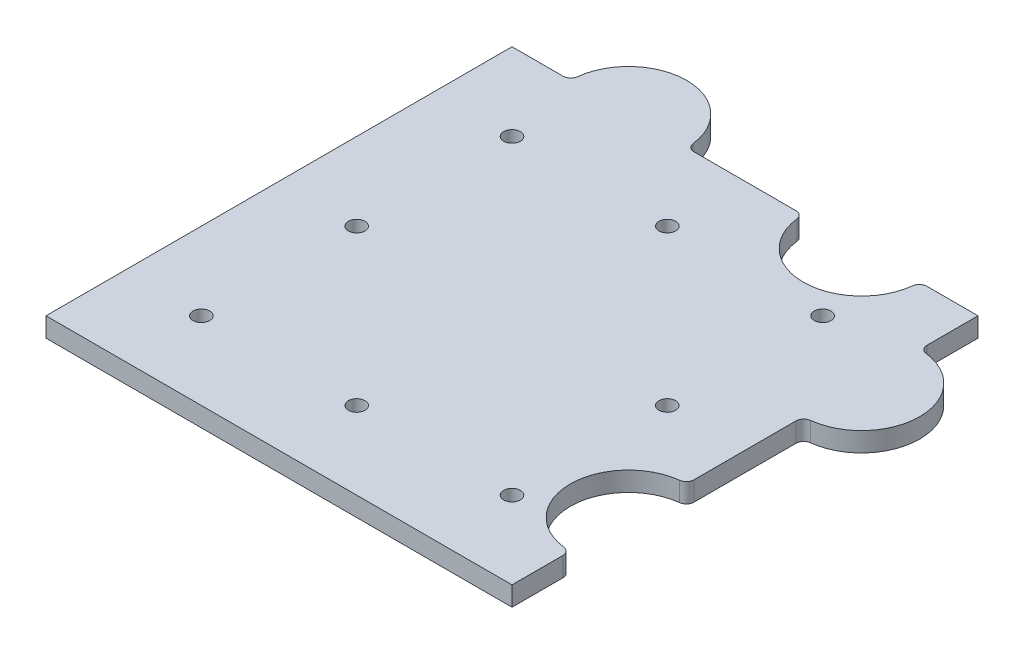
from build123d import *

# Parameters (mm, degrees)
SKETCH1_R           = 2.15
BOSS_EXTRUDE1_DEPTH = 5
FILLET1_R           = 2


with BuildPart() as part:
    # Sketch1 → Boss-Extrude1 (new body)
    with BuildSketch(Plane(origin=(0, 0, 0), x_dir=(1, 0, 0), z_dir=(0, 1, 0))):
        with BuildLine():
            Line((60, -60), (-60, -60))
            Line((-60, -60), (-60, 60))
            Line((-60, 60), (-45, 60))
            ThreePointArc((-45, 60), (-30, 75), (-15, 60))
            Line((-15, 60), (15, 60))
            ThreePointArc((15, 60), (30, 45), (45, 60))
            Line((45, 60), (60, 60))
            Line((60, 60), (60, 45))
            ThreePointArc((60, 45), (75, 30), (60, 15))
            Line((60, 15), (60, -15))
            ThreePointArc((60, -15), (45, -30), (60, -45))
            Line((60, -45), (60, -60))
        make_face()
        with Locations((-40, -40)):
            Circle(SKETCH1_R, mode=Mode.SUBTRACT)
        with Locations((40, 40)):
            Circle(SKETCH1_R, mode=Mode.SUBTRACT)
        with Locations((-40, 40)):
            Circle(SKETCH1_R, mode=Mode.SUBTRACT)
        with Locations((0, 40)):
            Circle(SKETCH1_R, mode=Mode.SUBTRACT)
        with Locations((-40, 0)):
            Circle(SKETCH1_R, mode=Mode.SUBTRACT)
        with Locations((40, -40)):
            Circle(SKETCH1_R, mode=Mode.SUBTRACT)
        with Locations((40, 0)):
            Circle(SKETCH1_R, mode=Mode.SUBTRACT)
        with Locations((0, -40)):
            Circle(SKETCH1_R, mode=Mode.SUBTRACT)
    extrude(amount=BOSS_EXTRUDE1_DEPTH)

    # Fillet1
    fillet1_edges = [part.edges().sort_by_distance(p)[0] for p in [
        (-45, 2.5, -60),
        (-15, 2.5, -60),
        (15, 2.5, -60),
        (45, 2.5, -60),
        (60, 2.5, -45),
        (60, 2.5, -15),
        (60, 2.5, 15),
        (60, 2.5, 45),
    ]]
    fillet(fillet1_edges, radius=FILLET1_R)


solid = part.part
